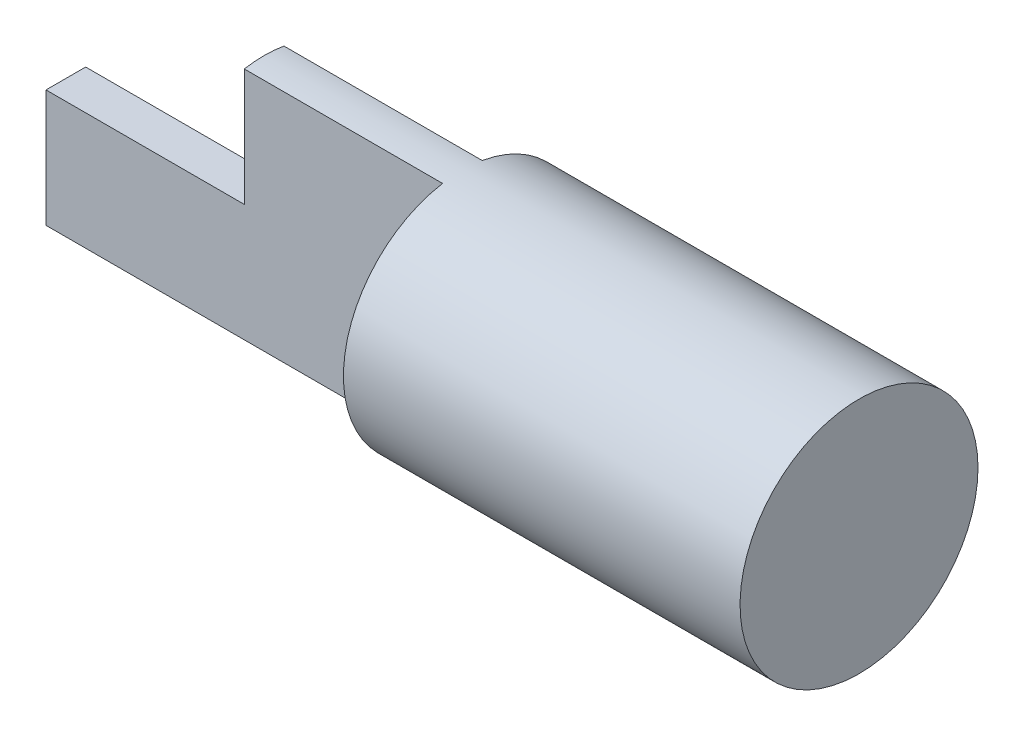
from build123d import *
from build123d.topology import SkipClean

# Parameters (mm, degrees)
SKETCH1_R           = 30
BOSS_EXTRUDE1_DEPTH = 100
BOSS_EXTRUDE2_START = 50
BOSS_EXTRUDE2_DEPTH = 50
BOSS_EXTRUDE3_START = 50
BOSS_EXTRUDE3_DEPTH = 50


with BuildPart() as part:
    # Sketch1 → Boss-Extrude1 (new body)
    with BuildSketch(Plane(origin=(0, 0, 0), x_dir=(0, 0, -1), z_dir=(1, 0, 0))):
        Circle(SKETCH1_R)
    extrude(amount=BOSS_EXTRUDE1_DEPTH)

    # Sketch2 → Boss-Extrude2 (add)
    with SkipClean():  # the faces are left unmerged after this step: merging them gives an invalid solid
        with BuildSketch(Plane.ZY.offset(BOSS_EXTRUDE2_START)):
            with BuildLine():
                Line((5, -29.580398915), (5, 29.580398915))
                ThreePointArc((5, 29.580398915), (0, 30), (-5, 29.580398915))
                Line((-5, 29.580398915), (-5, -29.580398915))
                ThreePointArc((-5, -29.580398915), (0, -30), (5, -29.580398915))
            make_face()
        extrude(amount=-BOSS_EXTRUDE2_DEPTH)

    # Sketch3 → Boss-Extrude3 (add)
    with SkipClean():  # the faces are left unmerged after this step: merging them gives an invalid solid
        with BuildSketch(Plane.ZY.offset(50).offset(BOSS_EXTRUDE3_START)):
            with BuildLine():
                Line((5, 0), (-5, 0))
                Line((-5, 0), (-5, -29.580398915))
                ThreePointArc((-5, -29.580398915), (0, -30), (5, -29.580398915))
                Line((5, -29.580398915), (5, 0))
            make_face()
        extrude(amount=-BOSS_EXTRUDE3_DEPTH)


solid = part.part
